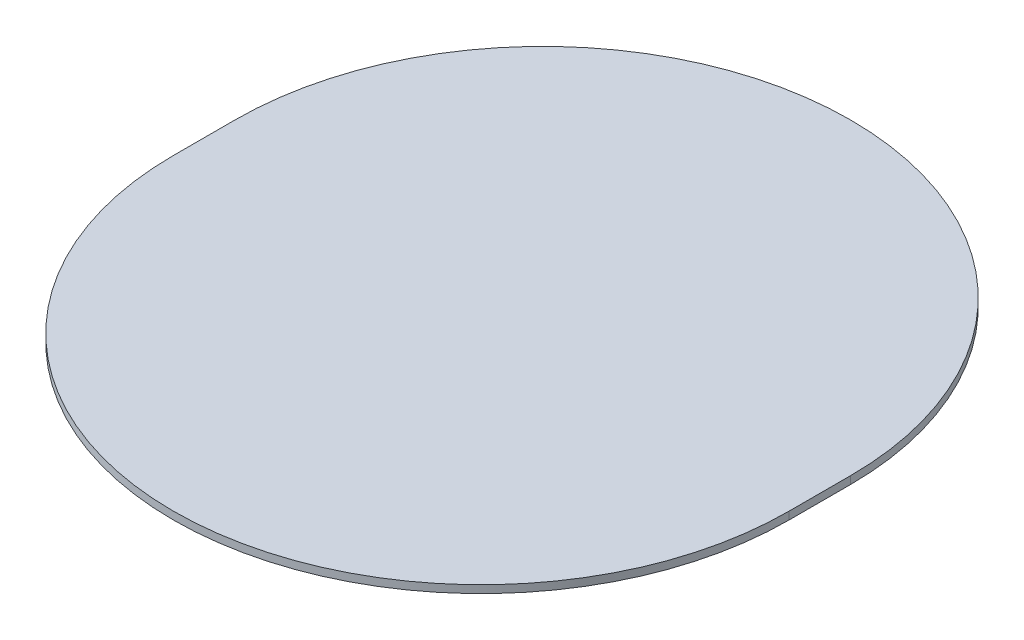
from build123d import *

# Parameters (mm, degrees)
BOSS_EXTRUDE1_DEPTH = 3.175


with BuildPart() as part:
    # Sketch1 → Boss-Extrude1 (new body)
    with BuildSketch(Plane(origin=(0, 0, 0), x_dir=(1, 0, 0), z_dir=(0, 1, 0))):
        with BuildLine():
            Line((127, -12.7), (127, 12.7))
            ThreePointArc((127, 12.7), (0, 139.7), (-127, 12.7))
            Line((-127, 12.7), (-127, -12.7))
            ThreePointArc((-127, -12.7), (0, -139.7), (127, -12.7))
        make_face()
    extrude(amount=BOSS_EXTRUDE1_DEPTH)


solid = part.part
